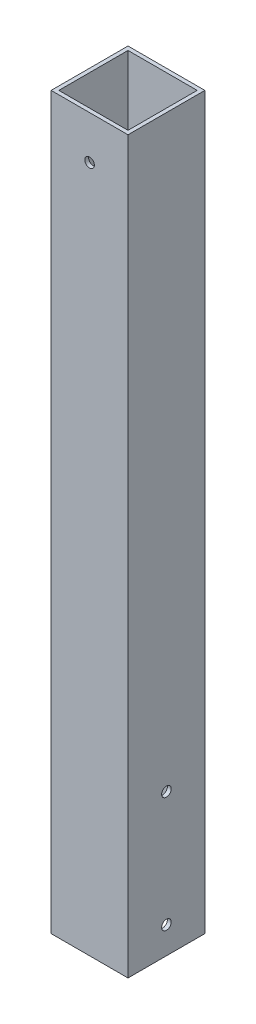
from build123d import *

# Parameters (mm, degrees)
SKETCH1_W           = 40
SKETCH1_H           = 40
SKETCH1_W_2         = 36
SKETCH1_H_2         = 36
EXTRUDE_THIN1_DEPTH = 380
SKETCH2_R           = 2.5
CUT_EXTRUDE1_DEPTH  = 50
SKETCH3_R           = 2.5
CUT_EXTRUDE2_DEPTH  = 50


with BuildPart() as part:
    # Sketch1 → Extrude-Thin1 (new body)
    with BuildSketch(Plane(origin=(0, 0, 0), x_dir=(1, 0, 0), z_dir=(0, 1, 0))):
        with Locations((-20, 20)):
            Rectangle(SKETCH1_W, SKETCH1_H)
        with Locations((-20, 20)):
            Rectangle(SKETCH1_W_2, SKETCH1_H_2, mode=Mode.SUBTRACT)
    extrude(amount=EXTRUDE_THIN1_DEPTH)

    # Sketch2 → Cut-Extrude1 (cut)
    with BuildSketch(Plane.XY):
        with Locations((-20, 357.5)):
            Circle(SKETCH2_R)
    extrude(amount=-CUT_EXTRUDE1_DEPTH, mode=Mode.SUBTRACT)

    # Sketch3 → Cut-Extrude2 (cut)
    with BuildSketch(Plane.ZY.offset(40)):
        with Locations((-20, 14)):
            Circle(SKETCH3_R)
        with Locations((-20, 74)):
            Circle(SKETCH3_R)
    extrude(amount=-CUT_EXTRUDE2_DEPTH, mode=Mode.SUBTRACT)


solid = part.part
